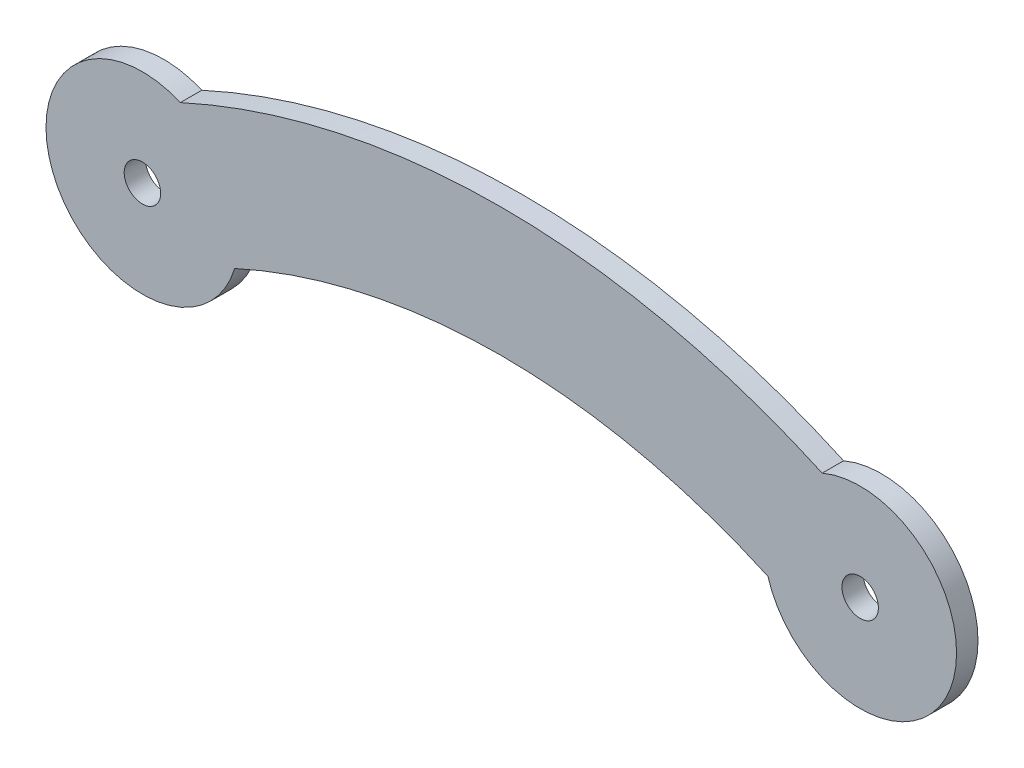
from build123d import *

# Parameters (mm, degrees)
SKETCH_1_R      = 0.85
EXTRUDE_1_DEPTH = 1


with BuildPart() as part:
    # Эскиз1 → Бобышка-Вытянуть1 (new body)
    with BuildSketch(Plane.XY):
        with BuildLine():
            ThreePointArc((4.307667052, -1.301539308), (-4.078385042, -1.901782178), (1.771878053, 4.136477749))
            ThreePointArc((1.771878053, 4.136477749), (16.75, 7.400322462), (31.728121947, 4.136477749))
            ThreePointArc((31.728121947, 4.136477749), (37.578385042, -1.901782178), (29.192332948, -1.301539308))
            ThreePointArc((29.192332948, -1.301539308), (16.75, 1.400322462), (4.307667052, -1.301539308))
        make_face()
        Circle(SKETCH_1_R, mode=Mode.SUBTRACT)
        with Locations((33.5, 0)):
            Circle(SKETCH_1_R, mode=Mode.SUBTRACT)
    extrude(amount=EXTRUDE_1_DEPTH)


solid = part.part
